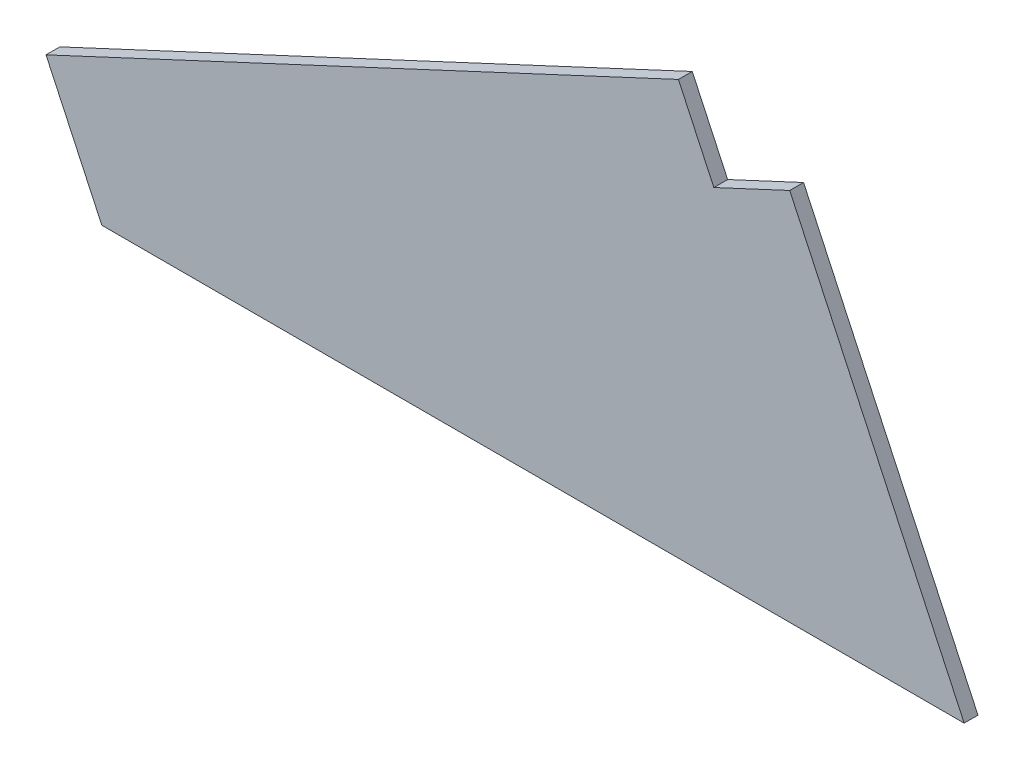
from build123d import *

# Parameters (mm, degrees)
BOSS_EXTRUDE1_DEPTH = 3.3


with BuildPart() as part:
    # Sketch1 → Boss-Extrude1 (new body)
    with BuildSketch(Plane.XY):
        Polygon((327.436217585, 0.003466677), (121.498383462, 0.003466677), (108.169003487, 28.58841428), (259.198908878, 99.014815774), (267.651274112, 80.888660034), (285.777429853, 89.341025269), align=None)
    extrude(amount=-BOSS_EXTRUDE1_DEPTH)


solid = part.part
